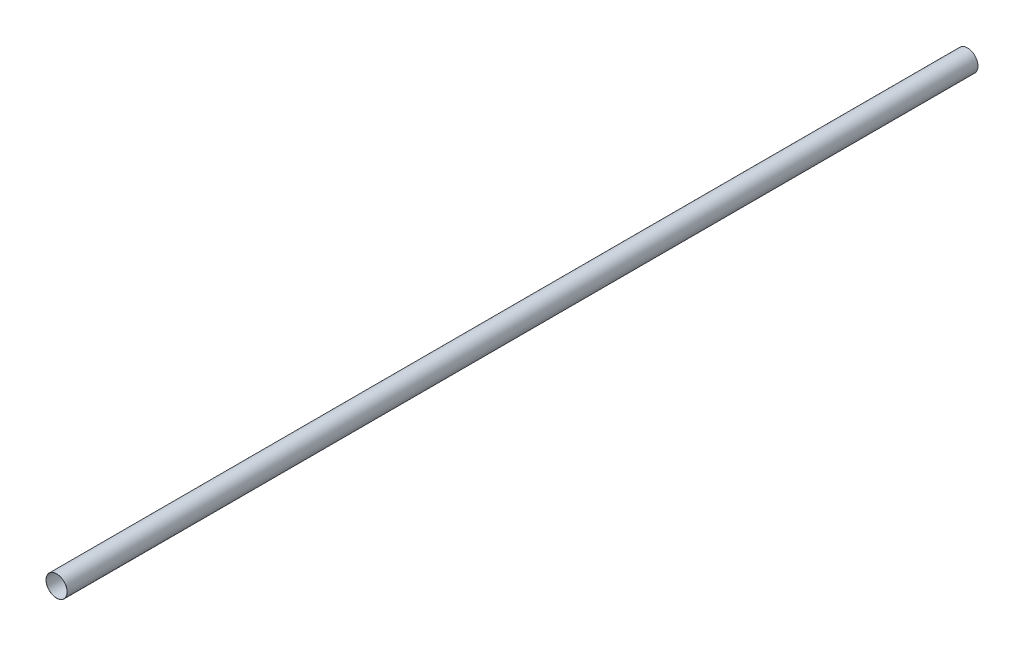
from build123d import *

# Parameters (mm, degrees)
SKETCH2_R           = 9.525
SKETCH2_R_2         = 9.4488
BOSS_EXTRUDE1_DEPTH = 820


with BuildPart() as part:
    # Sketch2 → Boss-Extrude1 (new body)
    with BuildSketch(Plane.XY):
        with Locations(Location((0, 0, 0), (0, 0, 180))):
            Circle(SKETCH2_R)
        with Locations(Location((0, 0, 0), (0, 0, 180))):
            Circle(SKETCH2_R_2, mode=Mode.SUBTRACT)
    extrude(amount=BOSS_EXTRUDE1_DEPTH)


solid = part.part
